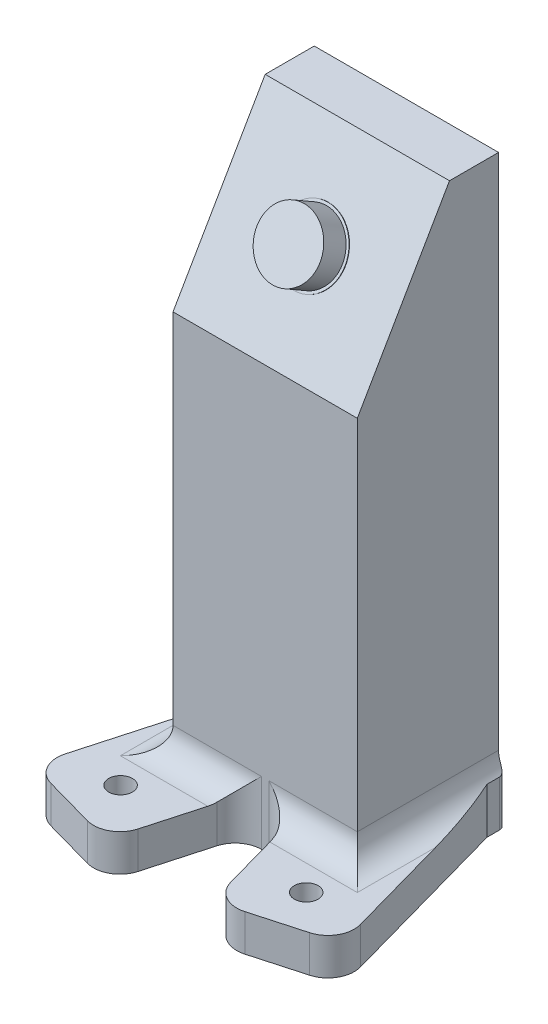
from build123d import *

# Parameters (mm, degrees)
AUFSATZ_LINEAR_AUSTRAGEN1_DEPTH = 35
SKIZZE3_R                       = 6
AUFSATZ_LINEAR_AUSTRAGEN2_DEPTH = 5
SKIZZE4_R                       = 6.5
AUFSATZ_LINEAR_AUSTRAGEN3_DEPTH = 0.1
SKIZZE9_R                       = 1.425
SCHNITT_LINEAR_AUSTRAGEN2_DEPTH = 10
SKIZZE10_R                      = 2.25
AUFSATZ_LINEAR_AUSTRAGEN4_DEPTH = 7
VERRUNDUNG1_R                   = 5
VERRUNDUNG2_R                   = 1


with BuildPart() as part:
    # Skizze1 → Aufsatz-Linear austragen1 (new body)
    with BuildSketch(Plane(origin=(0, 0, 0), x_dir=(0, 0, -1), z_dir=(1, 0, 0))):
        Polygon((0, 0), (17.5, 0), (26.82, 0), (26.82, 110.310889132), (17.5, 110.310889132), (0, 80), align=None)
    extrude(amount=AUFSATZ_LINEAR_AUSTRAGEN1_DEPTH)

    # Skizze3 → Aufsatz-Linear austragen2 (add)
    with BuildSketch(Plane(origin=(0, 20, 34.641016151), x_dir=(1, 0, 0), z_dir=(0, 0.4999999999999977, 0.86602540378444))):
        with Locations(Location((17.5, 86.782032303, 0), (0, 0, 90))):
            Circle(SKIZZE3_R)
    extrude(amount=AUFSATZ_LINEAR_AUSTRAGEN2_DEPTH)

    # Skizze4 → Aufsatz-Linear austragen3 (add)
    with BuildSketch(Plane(origin=(0, 20, 34.641016151), x_dir=(1, 0, 0), z_dir=(0, 0.4999999999999977, 0.8660254037844399))):
        with Locations(Location((17.5, 86.782032303, 0), (0, 0, 90))):
            Circle(SKIZZE4_R)
    extrude(amount=AUFSATZ_LINEAR_AUSTRAGEN3_DEPTH)

    # Skizze9 → Schnitt-Linear austragen2 (cut)
    with BuildSketch(Plane.XZ):
        with Locations(Location((17.498844944, -21.644236877, 0), (0, 0, 270))):
            Circle(SKIZZE9_R)
    extrude(amount=-SCHNITT_LINEAR_AUSTRAGEN2_DEPTH, mode=Mode.SUBTRACT)

    # Skizze10 → Aufsatz-Linear austragen4 (add)
    # profile 1 of 2: a face of its own
    with BuildSketch(Plane.XZ):
        Polygon((35, -26.82), (36.222689888, -26.82), (36.222689888, -23.396698607), (46.889907729, 14.777378017), (27.627810102, 20.159904842), (21.994403466, 0), align=None)
        with Locations(Location((35.124354886, 9.830031101, 0), (0, 0, 270))):
            Circle(SKIZZE10_R, mode=Mode.SUBTRACT)
    # profile 2 of 2: a face of its own
    with BuildSketch(Plane.XZ):
        Polygon((-1.222689888, -26.82), (-1.222689888, -23.396698607), (-11.889907729, 14.777378017), (7.372189898, 20.159904842), (13.005596534, 0), (0, -26.82), align=None)
        with Locations(Location((-0.124354886, 9.830031101, 0), (0, 0, 90))):
            Circle(SKIZZE10_R, mode=Mode.SUBTRACT)
    extrude(amount=-AUFSATZ_LINEAR_AUSTRAGEN4_DEPTH)

    # Verrundung1
    verrundung1_edges = [part.edges().sort_by_distance(p)[0] for p in [
        (6.502798267, 7, 0),
        (28.497201733, 7, 0),
        (35, 7, -13.41),
        (0, 7, -13.41),
        (-11.889907729, 3.5, 14.777378017),
        (7.372189898, 3.5, 20.159904842),
        (46.889907729, 3.5, 14.777378017),
        (27.627810102, 3.5, 20.159904842),
        (21.994403466, 3.5, 0),
        (13.005596534, 3.5, 0),
    ]]
    fillet(verrundung1_edges, radius=VERRUNDUNG1_R)

    # Verrundung2
    verrundung2_edges = [part.edges().sort_by_distance(p)[0] for p in [
        (36.222689888, 4.362018901, -26.82),
        (-1.222689888, 4.362018901, -26.82),
    ]]
    fillet(verrundung2_edges, radius=VERRUNDUNG2_R)


solid = part.part
